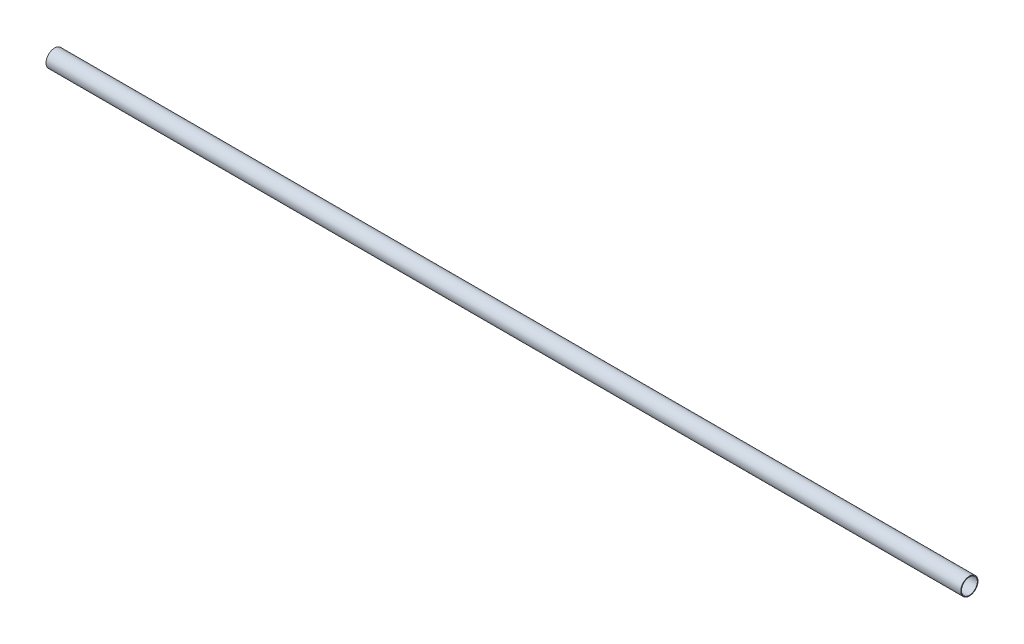
from build123d import *

# Parameters (mm, degrees)
CROQUIS1_R              = 25.4
CROQUIS1_R_2            = 23.4
SALIENTE_EXTRUIR1_DEPTH = 1350


with BuildPart() as part:
    # Croquis1 → Saliente-Extruir1 (new, symmetric)
    with BuildSketch(Plane(origin=(0, 0, 0), x_dir=(0, 0, -1), z_dir=(1, 0, 0))):
        Circle(CROQUIS1_R)
        Circle(CROQUIS1_R_2, mode=Mode.SUBTRACT)
    extrude(amount=SALIENTE_EXTRUIR1_DEPTH, both=True)


solid = part.part
